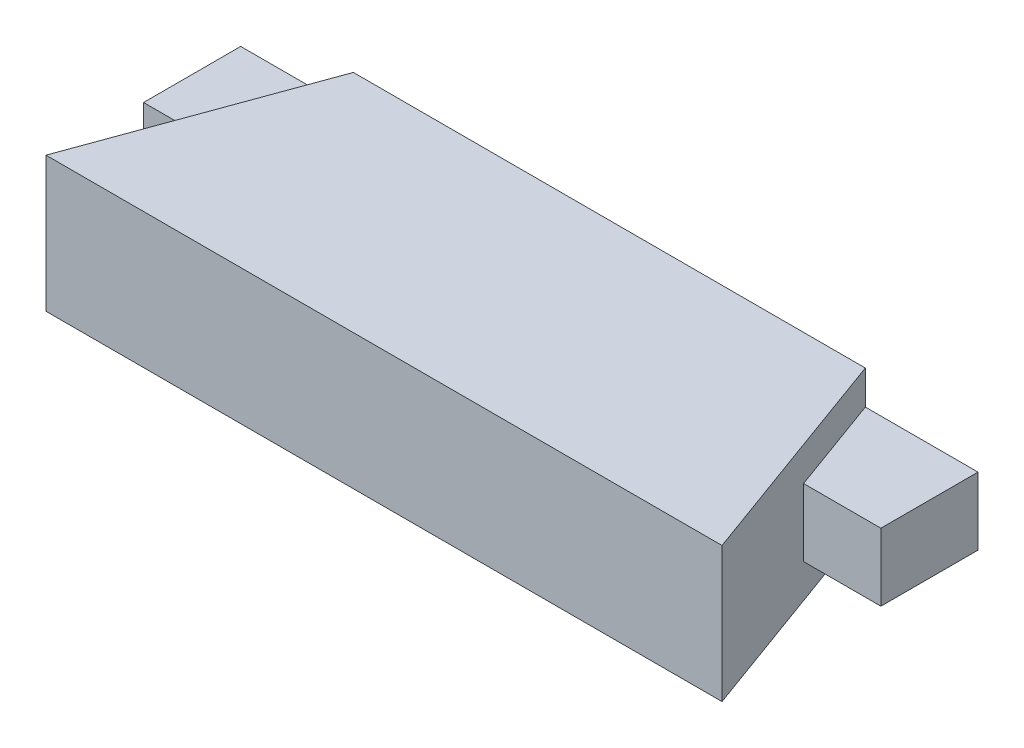
from build123d import *

# Parameters (mm, degrees)
SALIENTE_EXTRUIR4_DEPTH = 30
CROQUIS6_W              = 163.6
CROQUIS6_H              = 15
SALIENTE_EXTRUIR6_DEPTH = 21.55


with BuildPart() as part:
    # Croquis3 → Saliente-Extruir4 (new body)
    with BuildSketch(Plane(origin=(0, 0, 0), x_dir=(1, 0, 0), z_dir=(0, 1, 0))):
        Polygon((-75, 0), (75, 0), (56.801488287, 50), (-56.801488287, 50), align=None)
    extrude(amount=SALIENTE_EXTRUIR4_DEPTH)

    # Croquis6 → Saliente-Extruir6 (add)
    with BuildSketch(Plane(origin=(0, 0, -50), x_dir=(-1, 0, 0), z_dir=(0, 0, -1))):
        with Locations((0, 15)):
            Rectangle(CROQUIS6_W, CROQUIS6_H)
    extrude(amount=-SALIENTE_EXTRUIR6_DEPTH)


solid = part.part
